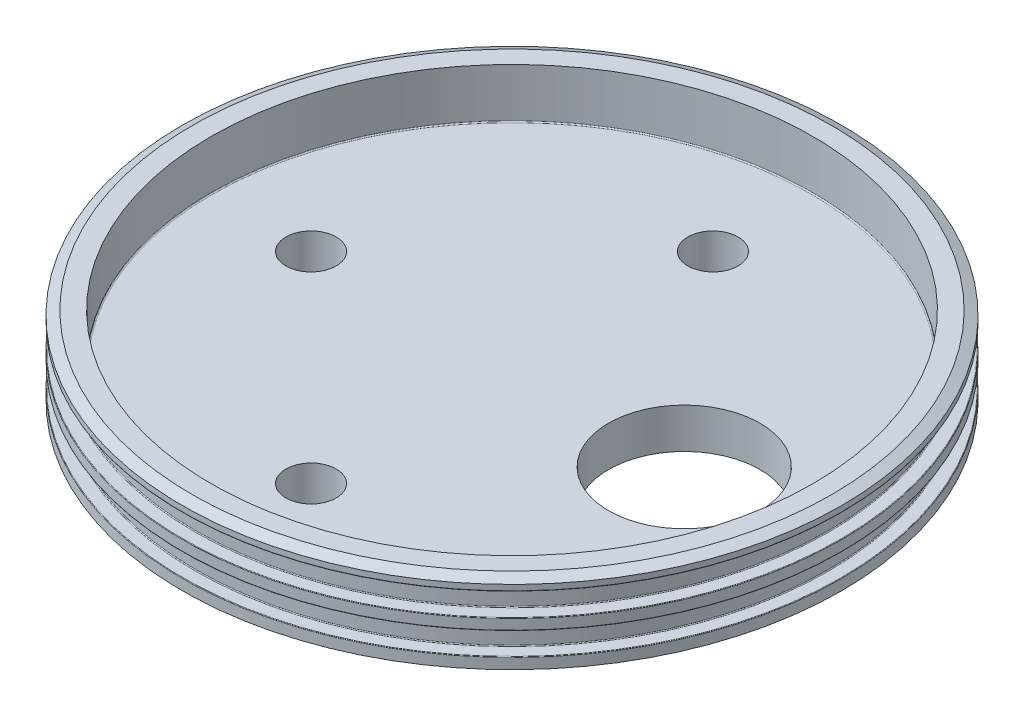
from build123d import *

# Parameters (mm, degrees)
SKETCH6_R                                = 66.04
BOSS_EXTRUDE1_DEPTH                      = 2.54
PIPE_TAP_DRILL_FOR_1_4_TAP_GN2_D         = 11.1252
CNC_ID_FILLET_R                          = 0.1778
CNC_OD_FILLET_R                          = 0.127
CNC_CHAMFERS_SIZE                        = 1.016
CNC_CHAMFERS_SIZE2                       = 2.178819031
CNC_BORE_FILLET_R                        = 0.254
SKETCH7_R                                = 16.764
CUT_EXTRUDE1_SIPHON_DEPTH                = 105.994177631
PIPE_TAP_DRILL_FOR_1_4_TAP_RELIEF_VALV_D = 11.1252
PIPE_TAP_DRILL_FOR_1_4_TAP_VENT_VALVE_D  = 11.1252


with BuildPart() as part:
    # Sketch1 → Revolve1 (revolve)
    with BuildSketch(Plane.XY, mode=Mode.PRIVATE) as revolve1_sk:
        Polygon((0, 0), (72.898, 0), (72.898, 2.4638), (69.977, 2.4638), (69.977, 7.4422), (72.898, 7.4422), (72.898, 9.906), (69.977, 9.906), (69.977, 14.986), (72.898, 14.986), (72.898, 17.3482), (66.548, 17.3482), (66.548, 6.35), (0, 6.35), align=None)
    revolve(revolve1_sk.sketch.rotate(Axis((0, 48.192213231, 0), (0, -1, 0)), 180), axis=Axis((0, 48.192213231, 0), (0, -1, 0)))

    # Sketch6 → Boss-Extrude1 (add)
    with BuildSketch(Plane.XZ):
        Circle(SKETCH6_R)
    extrude(amount=BOSS_EXTRUDE1_DEPTH)

    # Pipe Tap Drill for 1/4 Tap - GN2 (through all)
    with Locations(Plane(origin=(0, 6.35, 0), x_dir=(1, 0, 0), z_dir=(0, 1, 0))):
        with Locations((-44.45, 0)):
            Hole(PIPE_TAP_DRILL_FOR_1_4_TAP_GN2_D / 2)

    # CNC ID Fillet
    cnc_id_fillet_edges = [part.edges().sort_by_distance(p)[0] for p in [
        (69.977, 14.986, 0),
        (69.977, 9.906, 0),
        (69.977, 7.4422, 0),
        (69.977, 2.4638, 0),
        (-66.04, 0, 0),
    ]]
    fillet(cnc_id_fillet_edges, radius=CNC_ID_FILLET_R)

    # CNC OD Fillet
    cnc_od_fillet_edges = [part.edges().sort_by_distance(p)[0] for p in [
        (72.898, 14.986, 0),
        (72.898, 9.906, 0),
        (72.898, 7.4422, 0),
        (72.898, 2.4638, 0),
        (-66.04, -2.54, 0),
    ]]
    fillet(cnc_od_fillet_edges, radius=CNC_OD_FILLET_R)

    # CNC Chamfers
    cnc_chamfers_edges = [part.edges().sort_by_distance(p)[0] for p in [
        (72.898, 17.3482, 0),
    ]]
    cnc_chamfers_side = [part.faces().sort_by_distance(p)[0] for p in [
        (72.898, 16.2306, 0),
    ]]
    chamfer(cnc_chamfers_edges, length=CNC_CHAMFERS_SIZE, length2=CNC_CHAMFERS_SIZE2, reference=cnc_chamfers_side[0])

    # CNC Bore Fillet
    cnc_bore_fillet_edges = [part.edges().sort_by_distance(p)[0] for p in [
        (66.548, 6.35, 0),
    ]]
    fillet(cnc_bore_fillet_edges, radius=CNC_BORE_FILLET_R)

    # Sketch7 → Cut-Extrude1-Siphon (cut, through all)
    with BuildSketch(Plane(origin=(0, -2.54, 0), x_dir=(-1, 0, 0), z_dir=(0, -1, 0))):
        with Locations(Location((-38.1, 0, 0), (0, 0, 180))):
            Circle(SKETCH7_R)
    extrude(amount=-CUT_EXTRUDE1_SIPHON_DEPTH, mode=Mode.SUBTRACT)

    # Pipe Tap Drill for 1/4 Tap - Relief Valve (through all)
    with Locations(Plane(origin=(0, -2.54, 0), x_dir=(-1, 0, 0), z_dir=(0, -1, 0))):
        with Locations((0, 44.45)):
            Hole(PIPE_TAP_DRILL_FOR_1_4_TAP_RELIEF_VALV_D / 2)

    # Pipe Tap Drill for 1/4 Tap - Vent Valve (through all)
    with Locations(Plane(origin=(0, -2.54, 0), x_dir=(-1, 0, 0), z_dir=(0, -1, 0))):
        with Locations((0, -44.45)):
            Hole(PIPE_TAP_DRILL_FOR_1_4_TAP_VENT_VALVE_D / 2)


solid = part.part
